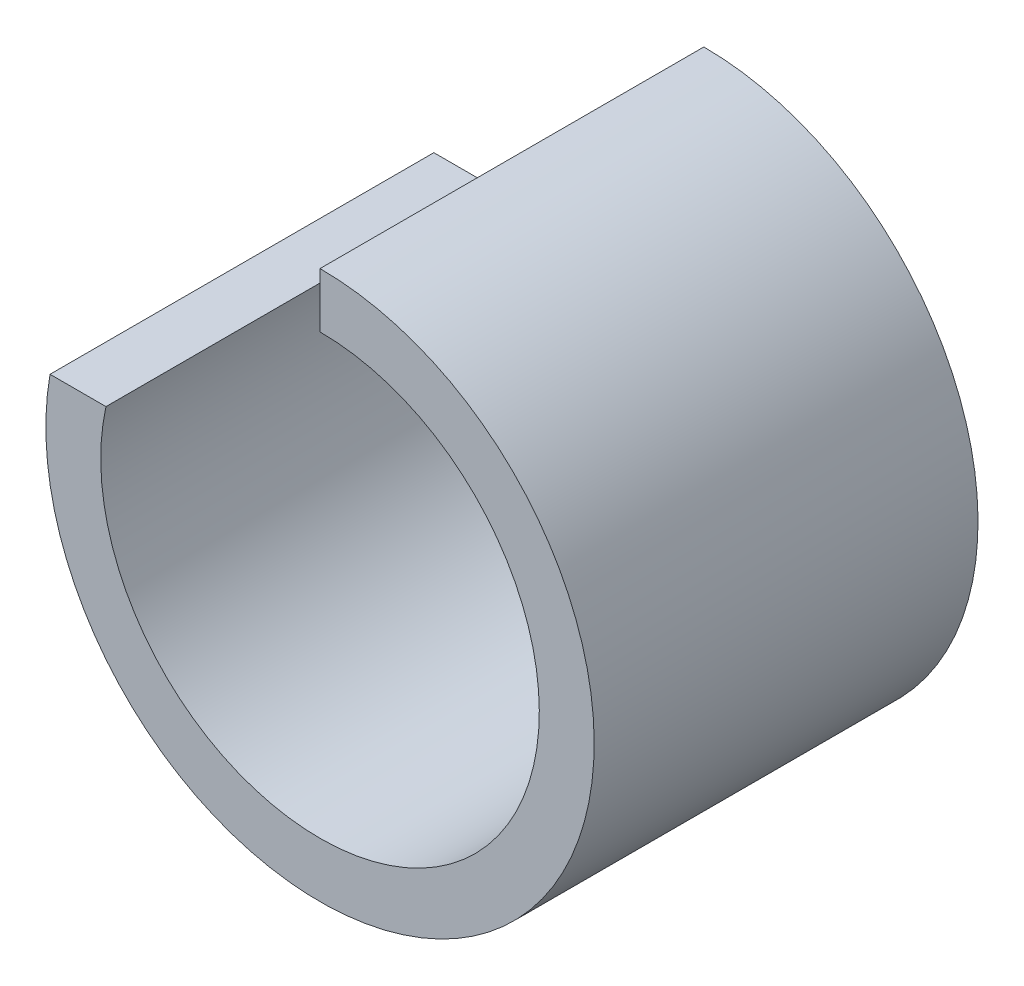
from build123d import *

# Parameters (mm, degrees)
BOSS_EXTRUDE1_DEPTH = 14


with BuildPart() as part:
    # Sketch1 → Boss-Extrude1 (new body)
    with BuildSketch(Plane.XY):
        with BuildLine():
            Line((0, 10), (0, 7.998072429))
            ThreePointArc((0, 7.998072429), (5.004031153, -6.239297621), (-7.807291055, 1.736481777))
            Line((-7.807291055, 1.736481777), (-9.84807753, 1.736481777))
            ThreePointArc((-9.84807753, 1.736481777), (6.427876097, -7.660444431), (0, 10))
        make_face()
    extrude(amount=BOSS_EXTRUDE1_DEPTH)


solid = part.part
